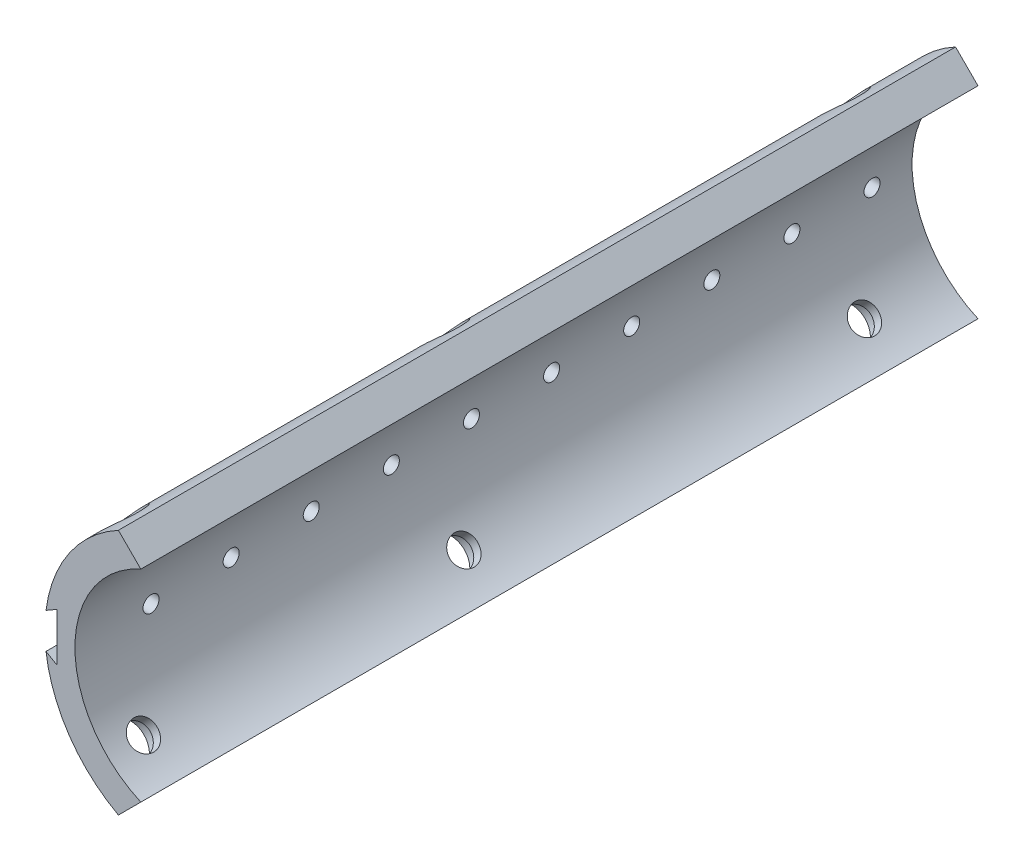
from build123d import *

# Parameters (mm, degrees)
SKETCH_1_R                          = 35
SKETCH_1_R_2                        = 27.5
EXTRUDE_1_DEPTH                     = 209
CUT_EXTRUDE_START                   = -209
CUT_EXTRUDE_1_DEPTH                 = 424.781284101
CUT_EXTRUDE_2_DEPTH                 = 209
F_4_0MM_1_D                         = 4
PATTERN_LINEAR_1_COUNT              = 10
PATTERN_LINEAR_1_PITCH              = 20
HOLE_WIZARD_1_D                     = 7
HOLE_WIZARD_1_CBORE_D               = 11
HOLE_WIZARD_1_CBORE_DEPTH           = 5
PATTERN_CIRCULAR_1_COUNT            = 2
PATTERN_CIRCULAR_1_ANGLE            = 90
PATTERN_LINEAR_2_COUNT              = 2
PATTERN_LINEAR_2_PITCH              = 100
PATTERN_LINEAR_2_COPY_1_D           = 7
PATTERN_LINEAR_2_COPY_1_CBORE_D     = 11
PATTERN_LINEAR_2_COPY_1_CBORE_DEPTH = 5
PATTERN_LINEAR_3_COUNT              = 2
PATTERN_LINEAR_3_PITCH              = 180
PATTERN_LINEAR_3_COPY_1_D           = 7
PATTERN_LINEAR_3_COPY_1_CBORE_D     = 11
PATTERN_LINEAR_3_COPY_1_CBORE_DEPTH = 5


with BuildPart() as part:
    # 草图1 → 凸台-拉伸1 (new body)
    with BuildSketch(Plane.XY):
        Circle(SKETCH_1_R)
        Circle(SKETCH_1_R_2, mode=Mode.SUBTRACT)
    extrude(amount=EXTRUDE_1_DEPTH)

    # 草图2 → 切除-拉伸1 (cut)
    with BuildSketch(Plane(origin=(0, 0, 0), x_dir=(-1, 0, 0), z_dir=(0, 0, -1)).offset(CUT_EXTRUDE_START)):
        Polygon((156.853201964, 170.995337588), (16.646014639, 30.788150263), (-38.262506682, -24.120371059), (-178.469694008, -164.327558384), (-458.884068658, 116.086816266), (-123.561172686, 451.409712238), align=None)
    cut_extrude_1 = extrude(amount=CUT_EXTRUDE_1_DEPTH, mode=Mode.SUBTRACT)

    # 镜向1: 切除-拉伸1 across plane
    add(cut_extrude_1.mirror(Plane.ZX), mode=Mode.SUBTRACT)

    # 草图3 → 切除-拉伸2 (cut)
    with BuildSketch(Plane(origin=(0, 0, 0), x_dir=(-1, 0, 0), z_dir=(0, 0, -1))):
        Polygon((32, -6), (32, 6), (42.392304845, 0), align=None)
    extrude(amount=-CUT_EXTRUDE_2_DEPTH, mode=Mode.SUBTRACT)

    # Ø4.0mm 暗销孔1 (through all)
    with Locations(Plane.ZY.offset(32)):
        with Locations((190, 0)):
            f_4_0mm_1 = Hole(F_4_0MM_1_D / 2)

    # 阵列(线性)1: Ø4.0mm 暗销孔1 ×10
    with Locations(*[(0, 0, -i * PATTERN_LINEAR_1_PITCH) for i in range(1, PATTERN_LINEAR_1_COUNT)]):
        add(f_4_0mm_1, mode=Mode.SUBTRACT)

    # 孔1 (through all)
    with Locations(Plane(origin=(-24.748737342, 24.748737342, 20), x_dir=(-0.707106781187, -0.707106781187, 0), z_dir=(-0.707106781187, 0.707106781187, 0))):
        with Locations((0, 0)):
            hole_wizard_1 = CounterBoreHole(HOLE_WIZARD_1_D / 2, HOLE_WIZARD_1_CBORE_D / 2, HOLE_WIZARD_1_CBORE_DEPTH)

    # 阵列(圆周)1: 孔1 ×2 about axis
    pattern_circular_1_axis = Axis((0, 0, 209), (0, 0, 1))
    for i in range(1, PATTERN_CIRCULAR_1_COUNT):
        add(hole_wizard_1.rotate(pattern_circular_1_axis, i * PATTERN_CIRCULAR_1_ANGLE / (PATTERN_CIRCULAR_1_COUNT - 1)), mode=Mode.SUBTRACT)

    # 阵列(线性)2: 孔1 ×2
    with Locations(*[(0, 0, i * PATTERN_LINEAR_2_PITCH) for i in range(1, PATTERN_LINEAR_2_COUNT)]):
        add(hole_wizard_1, mode=Mode.SUBTRACT)

    # 阵列(线性)2 copy 1 (through all)
    with Locations(Plane(origin=(-24.748737342, -24.748737342, 120), x_dir=(0.7071067811870024, -0.7071067811869975, 0), z_dir=(-0.7071067811869975, -0.7071067811870024, 0))):
        with Locations((0, 0)):
            CounterBoreHole(PATTERN_LINEAR_2_COPY_1_D / 2, PATTERN_LINEAR_2_COPY_1_CBORE_D / 2, PATTERN_LINEAR_2_COPY_1_CBORE_DEPTH)

    # 阵列(线性)3: 孔1 ×2
    with Locations(*[(0, 0, i * PATTERN_LINEAR_3_PITCH) for i in range(1, PATTERN_LINEAR_3_COUNT)]):
        add(hole_wizard_1, mode=Mode.SUBTRACT)

    # 阵列(线性)3 copy 1 (through all)
    with Locations(Plane(origin=(-24.748737342, -24.748737342, 200), x_dir=(0.7071067811870024, -0.7071067811869975, 0), z_dir=(-0.7071067811869975, -0.7071067811870024, 0))):
        with Locations((0, 0)):
            CounterBoreHole(PATTERN_LINEAR_3_COPY_1_D / 2, PATTERN_LINEAR_3_COPY_1_CBORE_D / 2, PATTERN_LINEAR_3_COPY_1_CBORE_DEPTH)


solid = part.part
